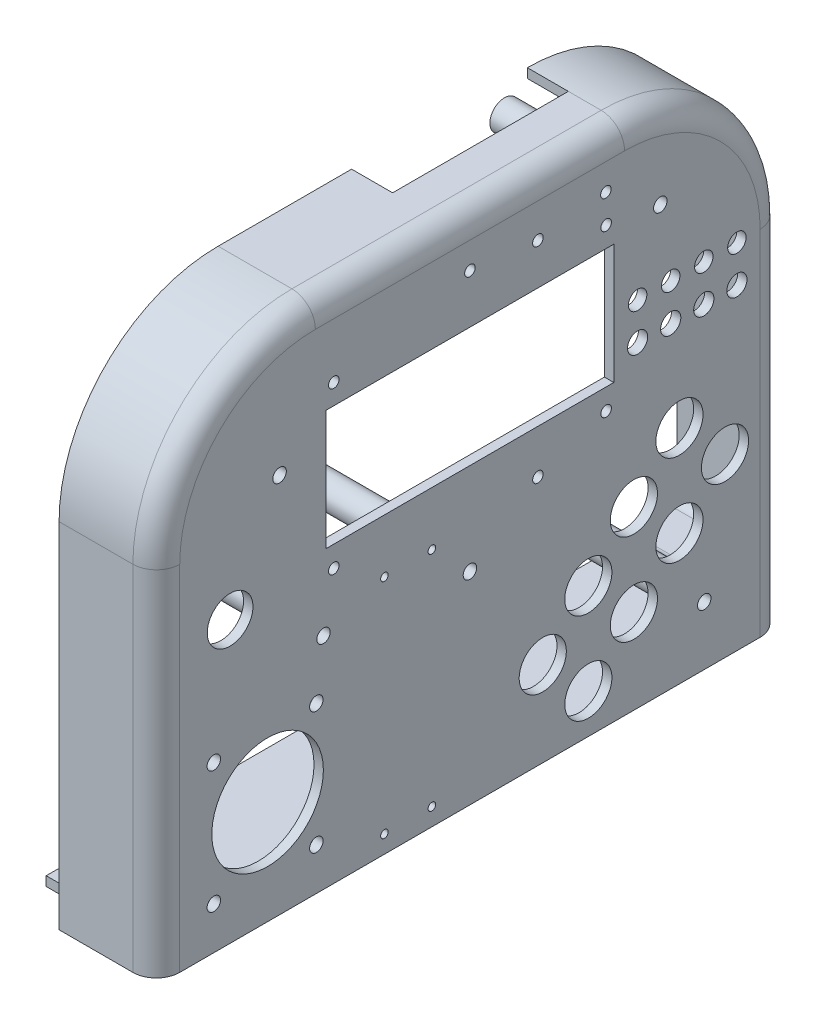
from build123d import *

# Parameters (mm, degrees)
SKETCH1_R           = 1.8
SKETCH1_R_2         = 3.15
SKETCH1_R_3         = 8.05
SKETCH1_R_4         = 2.3
SKETCH1_R_5         = 19.05
SKETCH1_R_6         = 7.8
SKETCH1_R_7         = 1.3
SKETCH1_R_8         = 3.45
SKETCH1_W           = 98.2
SKETCH1_H           = 40.9
BOSS_EXTRUDE1_DEPTH = 3.2
BOSS_EXTRUDE2_START = 30
BOSS_EXTRUDE2_DEPTH = 30
FILLET1_R           = 4.8
SKETCH20_R          = 2.3
CUT_EXTRUDE8_DEPTH  = 10
SKETCH6_R           = 5
SKETCH6_R_2         = 2.3
BOSS_EXTRUDE3_DEPTH = 50
SKETCH12_W          = 192.98
SKETCH12_H          = 3.2
BOSS_EXTRUDE7_DEPTH = 15
SKETCH8_R           = 2.3
CUT_EXTRUDE2_DEPTH  = 10
SKETCH19_W          = 14
SKETCH19_H          = 60
CUT_EXTRUDE7_DEPTH  = 10
BOSS_EXTRUDE8_START = -30
SKETCH21_W          = 3.6
SKETCH21_H          = 22.135238484
SKETCH21_W_2        = 34.225238484
SKETCH21_H_2        = 3.6
BOSS_EXTRUDE8_DEPTH = 30
FILLET5_R           = 3
FILLET6_R           = 8


with BuildPart() as part:
    # Sketch1 → Boss-Extrude1 (new body)
    with BuildSketch(Plane(origin=(0, 0, 0), x_dir=(0, 0, -1), z_dir=(1, 0, 0))):
        with BuildLine():
            Line((-52.79, 54.2), (52.79, 54.2))
            ThreePointArc((52.79, 54.2), (91.185898218, 38.295898218), (107.09, -0.1))
            Line((107.09, -0.1), (107.09, -120.8))
            Line((107.09, -120.8), (-107.09, -120.8))
            Line((-107.09, -120.8), (-107.09, -0.1))
            ThreePointArc((-107.09, -0.1), (-91.185898218, 38.295898218), (-52.79, 54.2))
        make_face()
        with Locations((46.5, 27.4)):
            Circle(SKETCH1_R, mode=Mode.SUBTRACT)
        with Locations((-46.5, -27.6)):
            Circle(SKETCH1_R, mode=Mode.SUBTRACT)
        with Locations((-46.5, 27.4)):
            Circle(SKETCH1_R, mode=Mode.SUBTRACT)
        with Locations((46.5, -27.6)):
            Circle(SKETCH1_R, mode=Mode.SUBTRACT)
        with Locations((57.25, -0.1)):
            Circle(SKETCH1_R_2, mode=Mode.SUBTRACT)
        with Locations((68.55, -0.1)):
            Circle(SKETCH1_R_2, mode=Mode.SUBTRACT)
        with Locations((79.85, -0.1)):
            Circle(SKETCH1_R_2, mode=Mode.SUBTRACT)
        with Locations((91.15, -0.1)):
            Circle(SKETCH1_R_2, mode=Mode.SUBTRACT)
        with Locations((71.533650814, -45.1)):
            Circle(SKETCH1_R_3, mode=Mode.SUBTRACT)
        with Locations((87.09, -60.656349186)):
            Circle(SKETCH1_R_3, mode=Mode.SUBTRACT)
        with Locations((71.533650814, -76.212698372)):
            Circle(SKETCH1_R_3, mode=Mode.SUBTRACT)
        with Locations((55.977301628, -91.769047558)):
            Circle(SKETCH1_R_3, mode=Mode.SUBTRACT)
        with Locations((40.420952442, -107.325396744)):
            Circle(SKETCH1_R_3, mode=Mode.SUBTRACT)
        with Locations((55.977301628, -60.656349186)):
            Circle(SKETCH1_R_3, mode=Mode.SUBTRACT)
        with Locations((40.420952442, -76.212698372)):
            Circle(SKETCH1_R_3, mode=Mode.SUBTRACT)
        with Locations((24.864603256, -91.769047558)):
            Circle(SKETCH1_R_3, mode=Mode.SUBTRACT)
        with Locations((-87.45, -106.35)):
            Circle(SKETCH1_R_4, mode=Mode.SUBTRACT)
        with Locations((-52.45, -106.35)):
            Circle(SKETCH1_R_4, mode=Mode.SUBTRACT)
        with Locations((-52.45, -64.55)):
            Circle(SKETCH1_R_4, mode=Mode.SUBTRACT)
        with Locations((-87.45, -64.55)):
            Circle(SKETCH1_R_4, mode=Mode.SUBTRACT)
        with Locations((-69.1, -85.45)):
            Circle(SKETCH1_R_5, mode=Mode.SUBTRACT)
        with Locations((-81.9, -25.1)):
            Circle(SKETCH1_R_6, mode=Mode.SUBTRACT)
        with Locations((46.42, 37.2)):
            Circle(SKETCH1_R, mode=Mode.SUBTRACT)
        with Locations((0, 37.2)):
            Circle(SKETCH1_R, mode=Mode.SUBTRACT)
        with Locations((23.21, 34.55)):
            Circle(SKETCH1_R, mode=Mode.SUBTRACT)
        with Locations((23.21, -35.45)):
            Circle(SKETCH1_R, mode=Mode.SUBTRACT)
        with Locations((-29.2, -38.8)):
            Circle(SKETCH1_R_7, mode=Mode.SUBTRACT)
        with Locations((-13, -38.8)):
            Circle(SKETCH1_R_7, mode=Mode.SUBTRACT)
        with Locations((-13, -114.8)):
            Circle(SKETCH1_R_7, mode=Mode.SUBTRACT)
        with Locations((-29.2, -114.8)):
            Circle(SKETCH1_R_7, mode=Mode.SUBTRACT)
        with Locations((91.15, -12.7)):
            Circle(SKETCH1_R_8, mode=Mode.SUBTRACT)
        with Locations((79.85, -12.7)):
            Circle(SKETCH1_R_8, mode=Mode.SUBTRACT)
        with Locations((68.55, -12.7)):
            Circle(SKETCH1_R_8, mode=Mode.SUBTRACT)
        with Locations((57.25, -12.7)):
            Circle(SKETCH1_R_8, mode=Mode.SUBTRACT)
        Rectangle(SKETCH1_W, SKETCH1_H, mode=Mode.SUBTRACT)
    extrude(amount=BOSS_EXTRUDE1_DEPTH)

    # Sketch3 → Boss-Extrude2 (add)
    with BuildSketch(Plane.ZY.offset(BOSS_EXTRUDE2_START)):
        with BuildLine():
            Line((-107.09, -0.1), (-107.09, -120.8))
            Line((-107.09, -120.8), (107.09, -120.8))
            Line((107.09, -120.8), (107.09, -0.1))
            ThreePointArc((107.09, -0.1), (91.185898218, 38.295898218), (52.79, 54.2))
            Line((52.79, 54.2), (-52.79, 54.2))
            ThreePointArc((-52.79, 54.2), (-91.185898218, 38.295898218), (-107.09, -0.1))
        make_face()
        with BuildLine():
            Line((-103.89, -0.1), (-103.89, -117.6))
            Line((-103.89, -117.6), (103.89, -117.6))
            Line((103.89, -117.6), (103.89, -0.1))
            ThreePointArc((103.89, -0.1), (88.923156519, 36.033156519), (52.79, 51))
            Line((52.79, 51), (-52.79, 51))
            ThreePointArc((-52.79, 51), (-88.923156519, 36.033156519), (-103.89, -0.1))
        make_face(mode=Mode.SUBTRACT)
    extrude(amount=-BOSS_EXTRUDE2_DEPTH)

    # Fillet1
    fillet1_edges = [part.edges().sort_by_distance(p)[0] for p in [
        (0, 36.033156519, -88.923156519),
        (0, -58.85, -103.89),
        (0, -58.85, 103.89),
        (0, 36.033156519, 88.923156519),
        (0, 51, 0),
    ]]
    fillet(fillet1_edges, radius=FILLET1_R)

    # Sketch20 → Cut-Extrude8 (cut)
    with BuildSketch(Plane(origin=(3.2, 0, 0), x_dir=(0, 0, -1), z_dir=(1, 0, 0))):
        with Locations((-65, 9.2)):
            Circle(SKETCH20_R)
        with Locations((0, -51.8)):
            Circle(SKETCH20_R)
        with Locations((-50, -45.8)):
            Circle(SKETCH20_R)
        with Locations((65, 24.2)):
            Circle(SKETCH20_R)
        with Locations((80, -100.8)):
            Circle(SKETCH20_R)
    extrude(amount=-CUT_EXTRUDE8_DEPTH, mode=Mode.SUBTRACT)

    # Sketch6 → Boss-Extrude3 (add)
    # profile 1 of 5: a face of its own
    with BuildSketch(Plane.ZY):
        with Locations((65, 9.2)):
            Circle(SKETCH6_R)
        with Locations(Location((65, 9.2, 0), (0, 0, 180))):
            Circle(SKETCH6_R_2, mode=Mode.SUBTRACT)
    # profile 2 of 5: a face of its own
    with BuildSketch(Plane.ZY):
        with Locations((-65, 24.2)):
            Circle(SKETCH6_R)
        with Locations(Location((-65, 24.2, 0), (0, 0, 180))):
            Circle(SKETCH6_R_2, mode=Mode.SUBTRACT)
    # profile 3 of 5: a face of its own
    with BuildSketch(Plane.ZY):
        with Locations((-80, -100.8)):
            Circle(SKETCH6_R)
        with Locations(Location((-80, -100.8, 0), (0, 0, 180))):
            Circle(SKETCH6_R_2, mode=Mode.SUBTRACT)
    # profile 4 of 5: a face of its own
    with BuildSketch(Plane.ZY):
        with Locations((50, -45.8)):
            Circle(SKETCH6_R)
        with Locations(Location((50, -45.8, 0), (0, 0, 180))):
            Circle(SKETCH6_R_2, mode=Mode.SUBTRACT)
    # profile 5 of 5: a face of its own
    with BuildSketch(Plane.ZY):
        with Locations((0, -51.8)):
            Circle(SKETCH6_R)
        with Locations(Location((0, -51.8, 0), (0, 0, 180))):
            Circle(SKETCH6_R_2, mode=Mode.SUBTRACT)
    extrude(amount=BOSS_EXTRUDE3_DEPTH)

    # Sketch12 → Boss-Extrude7 (add)
    with BuildSketch(Plane.ZY.offset(30)):
        with Locations((0, -119.2)):
            Rectangle(SKETCH12_W, SKETCH12_H)
    extrude(amount=BOSS_EXTRUDE7_DEPTH)

    # Sketch8 → Cut-Extrude2 (cut)
    with BuildSketch(Plane.XZ.offset(120.8)):
        with Locations(Location((-14.6, 92.09, 0), (0, 0, 270))):
            Circle(SKETCH8_R)
        with Locations(Location((-34.6, 92.09, 0), (0, 0, 270))):
            Circle(SKETCH8_R)
        with Locations(Location((-14.6, -92.09, 0), (0, 0, 270))):
            Circle(SKETCH8_R)
        with Locations(Location((-34.6, -92.09, 0), (0, 0, 270))):
            Circle(SKETCH8_R)
    extrude(amount=-CUT_EXTRUDE2_DEPTH, mode=Mode.SUBTRACT)

    # Sketch19 → Cut-Extrude7 (cut)
    with BuildSketch(Plane(origin=(0, 54.2, 0), x_dir=(1, 0, 0), z_dir=(0, 1, 0))):
        with Locations((-23, 22.79)):
            Rectangle(SKETCH19_W, SKETCH19_H)
    extrude(amount=-CUT_EXTRUDE7_DEPTH, mode=Mode.SUBTRACT)

    # Sketch21 → Boss-Extrude8 (add)
    with BuildSketch(Plane(origin=(0, 0, 0), x_dir=(0, 0, -1), z_dir=(1, 0, 0)).offset(BOSS_EXTRUDE8_START)):
        with BuildLine():
            Line((103.89, -102.6), (85, -102.6))
            Line((85, -102.6), (84.664761516, -102.6))
            ThreePointArc((84.664761516, -102.6), (85, -100.8), (84.664761516, -99))
            Line((84.664761516, -99), (85, -99))
            Line((85, -99), (103.89, -99))
            Line((103.89, -99), (103.89, -102.6))
        make_face()
        with Locations((65, 39.932380758)):
            Rectangle(SKETCH21_W, SKETCH21_H)
        with Locations((-86.777380758, 9.2)):
            Rectangle(SKETCH21_W_2, SKETCH21_H_2)
    extrude(amount=BOSS_EXTRUDE8_DEPTH)

    # Fillet5
    fillet5_edges = [part.edges().sort_by_distance(p)[0] for p in [
        (0, -105.715475947, -79.084524053),
        (0, -99, -91.877380758),
        (0, -102.6, -91.877380758),
        (-17.4, -102.6, -103.89),
        (-15, -99, -84.664761516),
        (-1.40588745, -102.6, -102.48411255),
        (-17.4, -99, -103.89),
        (-1.40588745, -99, -102.48411255),
        (-15, -102.6, -84.664761516),
    ]]
    fillet(fillet5_edges, radius=FILLET5_R)

    # Fillet6
    fillet6_edges = [part.edges().sort_by_distance(p)[0] for p in [
        (3.2, 38.295898218, 91.185898218),
        (3.2, -60.45, 107.09),
        (3.2, -60.45, -107.09),
        (3.2, 38.295898218, -91.185898218),
        (3.2, 54.2, 0),
    ]]
    fillet(fillet6_edges, radius=FILLET6_R)


solid = part.part
